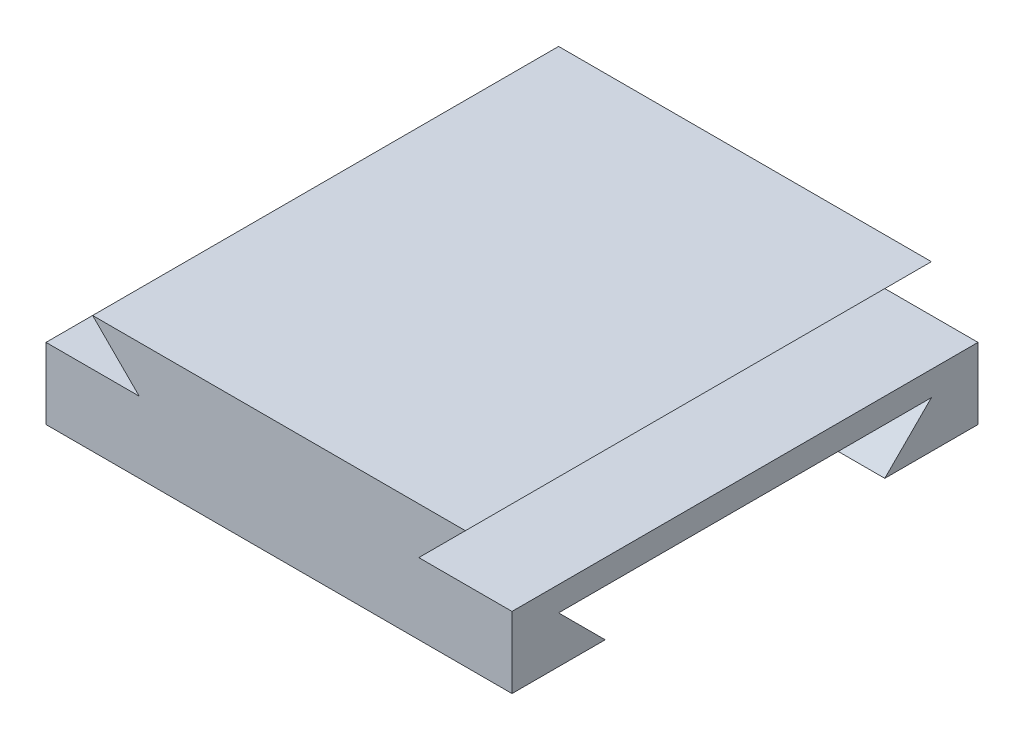
from build123d import *

# Parameters (mm, degrees)
SALIENTE_EXTRUIR1_DEPTH = 100
SALIENTE_EXTRUIR2_DEPTH = 100


with BuildPart() as part:
    # Croquis1 → Saliente-Extruir1 (new body)
    with BuildSketch(Plane(origin=(0, 0, 0), x_dir=(0, 0, -1), z_dir=(1, 0, 0))):
        Polygon((-30, 3.5), (-40, 13.5), (40, 13.5), (30, 3.5), (50, 3.5), (50, 18.770945102), (-50, 18.770945102), (-50, 3.5), align=None)
    extrude(amount=SALIENTE_EXTRUIR1_DEPTH)

    # Croquis2 → Saliente-Extruir2 (add)
    with BuildSketch(Plane(origin=(0, 0, -50), x_dir=(-1, 0, 0), z_dir=(0, 0, -1))):
        Polygon((-80, 18.770945102), (-90, 28.770945102), (-10, 28.770945102), (-20, 18.770945102), align=None)
    extrude(amount=-SALIENTE_EXTRUIR2_DEPTH)


solid = part.part
